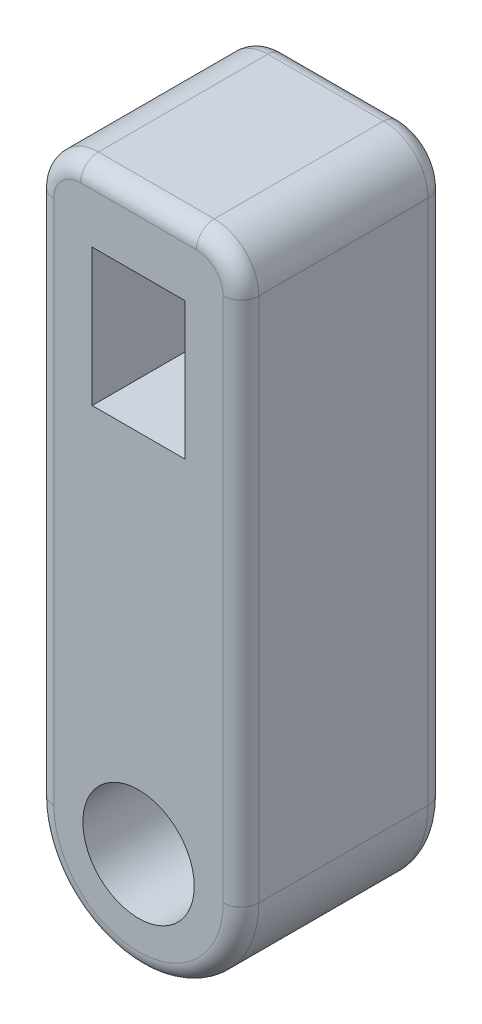
from build123d import *

# Parameters (mm, degrees)
SKETCH1_W           = 10.4
SKETCH1_H           = 15.4
SKETCH1_R           = 11.5
SKETCH1_R_2         = 6.25
BOSS_EXTRUDE1_DEPTH = 23
CHAMFER2_SIZE       = 1
CHAMFER2_SIZE2      = 2.747477419
FILLET2_R           = 5
FILLET3_R           = 2


with BuildPart() as part:
    # Sketch1 → Boss-Extrude1 (new body)
    # profile 1 of 2: a face of its own
    with BuildSketch(Plane.XY):
        with BuildLine():
            Line((-11.5, 64), (-11.5, 4e-09))
            ThreePointArc((-11.5, 4e-09), (2e-09, 11.5), (11.5, 0))
            Line((11.5, 0), (11.5, 64))
            Line((11.5, 64), (-11.5, 64))
        make_face()
        with Locations((0, 48.7)):
            Rectangle(SKETCH1_W, SKETCH1_H, mode=Mode.SUBTRACT)
    # profile 2 of 2: a face of its own
    with BuildSketch(Plane.XY):
        Circle(SKETCH1_R)
        Circle(SKETCH1_R_2, mode=Mode.SUBTRACT)
    extrude(amount=BOSS_EXTRUDE1_DEPTH)

    # Chamfer2
    chamfer2_edges = [part.edges().sort_by_distance(p)[0] for p in [
        (0, 56.4, 0),
        (-5.2, 48.7, 0),
        (0, 41, 0),
        (5.2, 48.7, 0),
    ]]
    chamfer2_side = [part.faces().sort_by_distance(p)[0] for p in [
        (0, 27.411701329, 0),
    ]]
    chamfer(chamfer2_edges, length=CHAMFER2_SIZE, length2=CHAMFER2_SIZE2, reference=chamfer2_side[0])

    # Fillet2
    fillet2_edges = [part.edges().sort_by_distance(p)[0] for p in [
        (-11.5, 64, 11.5),
        (11.5, 64, 11.5),
    ]]
    fillet(fillet2_edges, radius=FILLET2_R)

    # Fillet3
    fillet3_edges = [part.edges().sort_by_distance(p)[0] for p in [
        (-2e-09, -11.5, 23),
        (11.5, 29.5, 0),
        (-2e-09, -11.5, 0),
        (-11.5, 29.500000002, 0),
        (11.5, 29.5, 23),
        (0, 64, 0),
        (10.035533906, 62.535533906, 0),
        (-10.035533906, 62.535533906, 0),
        (0, 64, 23),
        (10.035533906, 62.535533906, 23),
        (-10.035533906, 62.535533906, 23),
        (-11.5, 29.500000002, 23),
    ]]
    fillet(fillet3_edges, radius=FILLET3_R)


solid = part.part
